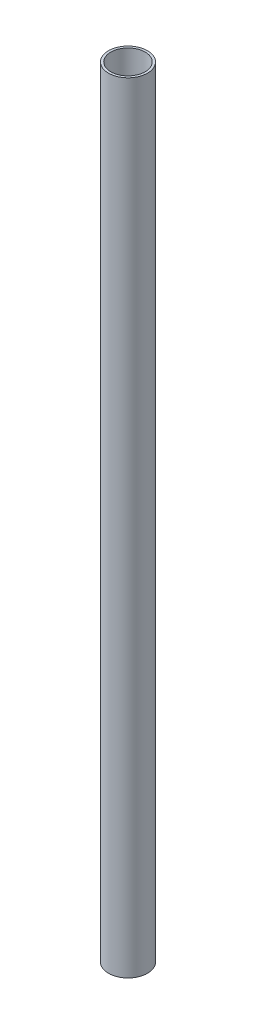
from build123d import *

# Parameters (mm, degrees)
SKETCH1_R           = 25
BOSS_EXTRUDE1_DEPTH = 1000
SKETCH2_R           = 22
CUT_EXTRUDE1_DEPTH  = 1001.624804809


with BuildPart() as part:
    # Sketch1 → Boss-Extrude1 (new body)
    with BuildSketch(Plane(origin=(0, 0, 0), x_dir=(1, 0, 0), z_dir=(0, 1, 0))):
        with Locations(Location((0, 0, 0), (0, 0, 270))):
            Circle(SKETCH1_R)
    extrude(amount=BOSS_EXTRUDE1_DEPTH)

    # Sketch2 → Cut-Extrude1 (cut, through all)
    with BuildSketch(Plane.XZ):
        with Locations(Location((0, 0, 0), (0, 0, 270))):
            Circle(SKETCH2_R)
    extrude(amount=-CUT_EXTRUDE1_DEPTH, mode=Mode.SUBTRACT)


solid = part.part
